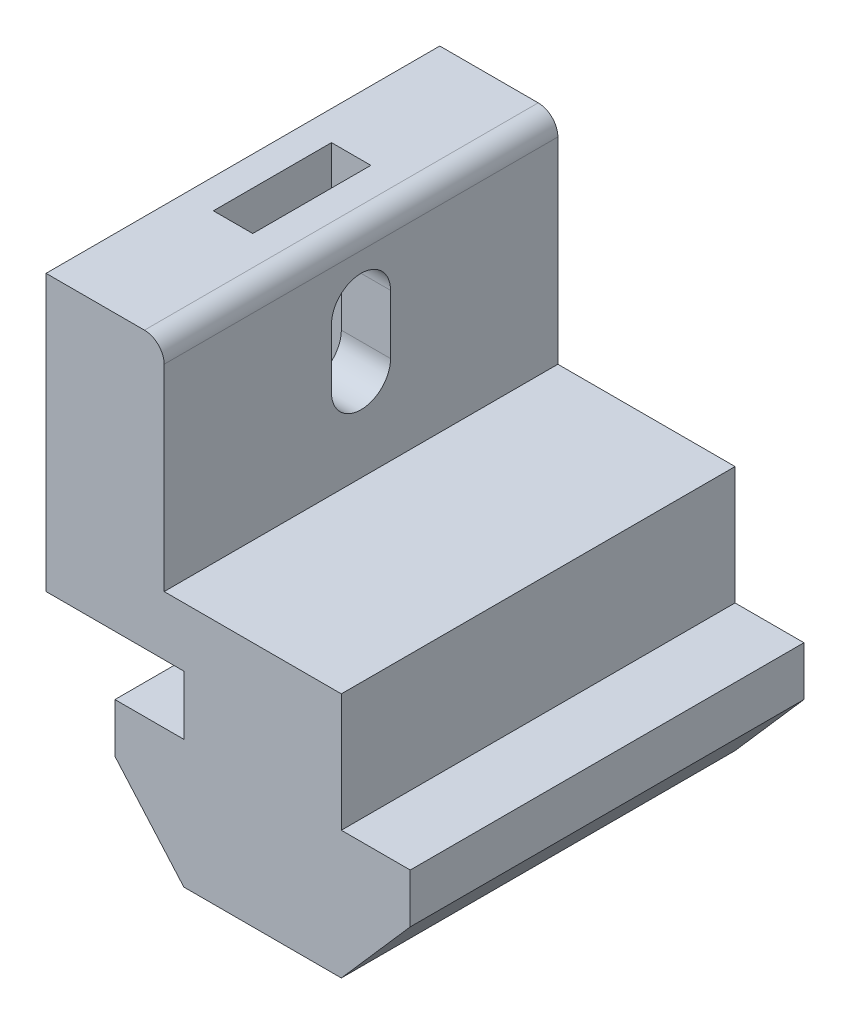
from build123d import *

# Parameters (mm, degrees)
ESTRUSIONE_ESTRUSIONE1_DEPTH = 20
TAGLIO_ESTRUSIONE1_REACH     = 37.979
ESTRUSIONE_ESTRUSIONE4_DEPTH = 0.6
SCHIZZO12_W                  = 2
SCHIZZO12_H                  = 6
TAGLIO_ESTRUSIONE2_DEPTH     = 11


with BuildPart() as part:
    # Schizzo2 → Estrusione-Estrusione1 (new body)
    with BuildSketch(Plane.XY):
        with BuildLine():
            Line((-4, 9.5), (-11, 9.5))
            Line((-11, 9.5), (-11, 23.5))
            Line((-11, 23.5), (-6, 23.5))
            ThreePointArc((-6, 23.5), (-5.292893219, 23.207106781), (-5, 22.5))
            Line((-5, 22.5), (-5, 12.5))
            Line((-5, 12.5), (4, 12.5))
            Line((4, 12.5), (4, 9.5))
            Line((4, 9.5), (4, 6.5))
            Line((4, 6.5), (7.5, 6.5))
            Line((7.5, 6.5), (7.5, 4))
            Line((7.5, 4), (4, 0))
            Line((4, 0), (-4, 0))
            Line((-4, 0), (-7.5, 4))
            Line((-7.5, 4), (-7.5, 6.5))
            Line((-7.5, 6.5), (-4, 6.5))
            Line((-4, 6.5), (-4, 9.5))
        make_face()
    extrude(amount=-ESTRUSIONE_ESTRUSIONE1_DEPTH)

    # Schizzo6 → Taglio-Estrusione1 (cut, up to next)
    with BuildSketch(Plane.ZY.offset(11), mode=Mode.PRIVATE) as taglio_estrusione1_sk1:
        with BuildLine():
            Line((-8.5, 20), (-8.5, 17))
            ThreePointArc((-8.5, 17), (-10, 15.5), (-11.5, 17))
            Line((-11.5, 17), (-11.5, 20))
            ThreePointArc((-11.5, 20), (-10, 21.5), (-8.5, 20))
        make_face()
    taglio_estrusione1_tool1 = extrude(taglio_estrusione1_sk1.sketch, amount=-TAGLIO_ESTRUSIONE1_REACH, mode=Mode.PRIVATE) & part.part
    add(taglio_estrusione1_tool1.solids().sort_by_distance((-11, 18.5, -10))[0], mode=Mode.SUBTRACT)

    # Schizzo11 → Estrusione-Estrusione4 (add)
    with BuildSketch(Plane(origin=(0, 0, -20), x_dir=(-1, 0, 0), z_dir=(0, 0, -1))):
        with BuildLine():
            Line((-1.916666667, 6), (-2.5, 6))
            add(Edge.make_bspline(
                [(-2.5, 6), (-2.484196549, 6.065431756), (-2.453302094, 6.193345487), (-2.388863743, 6.376101829), (-2.318665127, 6.549045511), (-2.234371075, 6.708938219), (-2.142426246, 6.858993324), (-2.037084049, 6.995807413), (-1.923204564, 7.122860063), (-1.797243944, 7.235613218), (-1.665147858, 7.337714716), (-1.525054993, 7.424768393), (-1.379783905, 7.499656106), (-1.228328086, 7.561350822), (-1.070236625, 7.607826795), (-0.906938753, 7.641546577), (-0.738006538, 7.66344436), (-0.623332441, 7.665581492), (-0.565104167, 7.666666667)],
                knots=[0, 0, 0, 0, 1.162005537, 2.271625781, 3.343758855, 4.383309926, 5.390229558, 6.379919256, 7.361854164, 8.333198761, 9.295911338, 10.242430842, 11.177959212, 12.116337295, 13.062827104, 14.020064771, 14.994644689, 16, 16, 16, 16], degree=3))
            add(Edge.make_bspline(
                [(-0.565104167, 7.666666667), (-0.480264789, 7.664105239), (-0.312436625, 7.659038256), (-0.065876681, 7.612768588), (0.171887412, 7.539550485), (0.398253158, 7.438384992), (0.608515961, 7.313608553), (0.795597451, 7.165102613), (0.956961828, 6.995732482), (1.092337101, 6.80865772), (1.198333527, 6.608726059), (1.276493935, 6.402954339), (1.324077057, 6.191830678), (1.330243806, 6.049281445), (1.333333333, 5.977864583)],
                knots=[0, 0, 0, 0, 1.083050992, 2.142477498, 3.193116406, 4.255571735, 5.30263384, 6.308962982, 7.297363603, 8.282367274, 9.249857812, 10.179914175, 11.08814088, 12, 12, 12, 12], degree=3))
            add(Edge.make_bspline(
                [(1.333333333, 5.977864583), (1.331172379, 5.909137679), (1.326943725, 5.774649792), (1.291038272, 5.578309869), (1.230613784, 5.393261183), (1.146912796, 5.218724739), (1.038564203, 5.055807179), (0.907314909, 4.904141953), (0.752238537, 4.763056374), (0.634720509, 4.682234495), (0.57421875, 4.640625)],
                knots=[0, 0, 0, 0, 1.024540389, 2.004866551, 2.965041327, 3.920577974, 4.882998113, 5.874504559, 6.905732034, 8, 8, 8, 8], degree=3))
            add(Edge.make_bspline(
                [(0.57421875, 4.640625), (0.643363437, 4.607236967), (0.780359061, 4.541085617), (0.967095758, 4.411353496), (1.136611813, 4.261563137), (1.231147291, 4.144669639), (1.278645833, 4.0859375)],
                knots=[0, 0, 0, 0, 1.015518401, 2.012035669, 3.001164323, 4, 4, 4, 4], degree=3))
            add(Edge.make_bspline(
                [(1.278645833, 4.0859375), (1.309922612, 4.043115961), (1.37196399, 3.958174116), (1.448544267, 3.821606468), (1.518018337, 3.683525131), (1.572154458, 3.540229091), (1.614077354, 3.393379209), (1.644044271, 3.24272333), (1.662660533, 3.088138431), (1.665326558, 2.983558111), (1.666666667, 2.930989583)],
                knots=[0, 0, 0, 0, 1.025084078, 2.033381695, 3.024893161, 4.013698104, 4.991890475, 5.976764909, 6.982997093, 8, 8, 8, 8], degree=3))
            add(Edge.make_bspline(
                [(1.666666667, 2.930989583), (1.663333999, 2.83997153), (1.656684346, 2.658363755), (1.597248208, 2.390053558), (1.505109333, 2.127777625), (1.374260737, 1.876924352), (1.214792507, 1.64221793), (1.025071762, 1.43221907), (0.807254146, 1.251707377), (0.56432937, 1.100888382), (0.301140417, 0.980326526), (0.019642889, 0.896648418), (-0.276107211, 0.842148704), (-0.478920764, 0.836304519), (-0.58203125, 0.833333333)],
                knots=[0, 0, 0, 0, 0.955779014, 1.907060117, 2.875433937, 3.871313158, 4.872415639, 5.851225146, 6.836215519, 7.83643374, 8.849228613, 9.86973379, 10.916971861, 12, 12, 12, 12], degree=3))
            add(Edge.make_bspline(
                [(-0.58203125, 0.833333333), (-0.651524236, 0.834945729), (-0.78826326, 0.838118387), (-0.9892869, 0.859807218), (-1.181170056, 0.899420085), (-1.364172166, 0.952726223), (-1.538455805, 1.020310887), (-1.703489143, 1.104474184), (-1.860287517, 1.203481259), (-2.007371283, 1.318500779), (-2.144722909, 1.447166124), (-2.268692254, 1.591761428), (-2.381346155, 1.74961375), (-2.479668199, 1.922556569), (-2.568136825, 2.108354904), (-2.640901459, 2.309387829), (-2.704946086, 2.523858156), (-2.73472252, 2.673316816), (-2.75, 2.75)],
                knots=[0, 0, 0, 0, 1.048658725, 2.063410685, 3.046034179, 4.001477787, 4.936774919, 5.862367409, 6.792675028, 7.730719943, 8.675894397, 9.627829632, 10.600096036, 11.597688215, 12.626045268, 13.701542398, 14.82072376, 16, 16, 16, 16], degree=3))
            Line((-2.75, 2.75), (-2.166666667, 2.75))
            add(Edge.make_bspline(
                [(-2.166666667, 2.75), (-2.151469125, 2.699951833), (-2.121908588, 2.602603799), (-2.071590606, 2.462500375), (-2.014263815, 2.33406399), (-1.952765349, 2.216352478), (-1.888176806, 2.108206588), (-1.815906231, 2.012485974), (-1.74130639, 1.924986312), (-1.685073305, 1.875689176), (-1.657552083, 1.8515625)],
                knots=[0, 0, 0, 0, 1.198163088, 2.33053128, 3.407730985, 4.417276592, 5.372219308, 6.28897303, 7.162600585, 8, 8, 8, 8], degree=3))
            add(Edge.make_bspline(
                [(-1.657552083, 1.8515625), (-1.621158441, 1.823504166), (-1.548483496, 1.767474107), (-1.430056781, 1.695971082), (-1.305507707, 1.634014892), (-1.172137598, 1.586688029), (-1.032824452, 1.54661523), (-0.885316488, 1.520391409), (-0.730915085, 1.502399091), (-0.625489239, 1.500811361), (-0.571614583, 1.5)],
                knots=[0, 0, 0, 0, 0.946170439, 1.889420265, 2.845303464, 3.807233317, 4.801018734, 5.828864929, 6.890507805, 8, 8, 8, 8], degree=3))
            add(Edge.make_bspline(
                [(-0.571614583, 1.5), (-0.51078665, 1.501143824), (-0.391842877, 1.503380473), (-0.218283853, 1.523949643), (-0.053170021, 1.553906125), (0.101665412, 1.600173093), (0.24825064, 1.657337532), (0.384530847, 1.729113142), (0.512295044, 1.813324768), (0.629906797, 1.909040348), (0.735662739, 2.013823125), (0.828778978, 2.123418828), (0.907939064, 2.237365369), (0.97179428, 2.356293307), (1.022216731, 2.479710161), (1.056542675, 2.607962273), (1.080409774, 2.740000053), (1.082353483, 2.829753852), (1.083333333, 2.875)],
                knots=[0, 0, 0, 0, 1.217147791, 2.380027433, 3.494444702, 4.572153297, 5.609568379, 6.639424714, 7.649109417, 8.668170816, 9.669597737, 10.625200337, 11.543417969, 12.441394052, 13.322311151, 14.205496177, 15.095365482, 16, 16, 16, 16], degree=3))
            add(Edge.make_bspline(
                [(1.083333333, 2.875), (1.080491345, 2.935563915), (1.074821509, 3.056390388), (1.031534147, 3.234151597), (0.960333399, 3.405423649), (0.860655878, 3.567284402), (0.739318097, 3.71729679), (0.597497555, 3.851143829), (0.43401656, 3.961588284), (0.283551089, 4.037895789), (0.150272941, 4.089964642), (0.036215798, 4.124646719), (-0.091475036, 4.154014937), (-0.231255399, 4.181337727), (-0.384178515, 4.204591659), (-0.5500779, 4.223983603), (-0.728987171, 4.239500107), (-0.852842194, 4.246429284), (-0.916666667, 4.25)],
                knots=[0, 0, 0, 0, 1.07054697, 2.135767047, 3.216561865, 4.33974944, 5.486079747, 6.621378074, 7.775625952, 8.963672916, 9.598146892, 10.304877434, 11.070270905, 11.915000392, 12.823868403, 13.805723172, 14.86925407, 16, 16, 16, 16], degree=3))
            Line((-0.916666667, 4.25), (-0.916666667, 4.916666667))
            add(Edge.make_bspline(
                [(-0.916666667, 4.916666667), (-0.836250216, 4.918031302), (-0.678734144, 4.920704288), (-0.448644721, 4.95303345), (-0.228622855, 4.997754616), (-0.02354462, 5.066255688), (0.163374419, 5.145816239), (0.325539394, 5.238398914), (0.460678382, 5.34131202), (0.568134658, 5.456144008), (0.648974654, 5.579300525), (0.708081563, 5.707660032), (0.742996455, 5.842347574), (0.747657265, 5.934266243), (0.75, 5.98046875)],
                knots=[0, 0, 0, 0, 1.321986639, 2.589447074, 3.816329219, 5.01088745, 6.139805852, 7.153945165, 8.075214402, 8.924034688, 9.728124013, 10.488707548, 11.240355623, 12, 12, 12, 12], degree=3))
            add(Edge.make_bspline(
                [(0.75, 5.98046875), (0.74923038, 6.014413134), (0.747699256, 6.081943876), (0.728390026, 6.180604717), (0.69937395, 6.276249331), (0.659483024, 6.368470979), (0.606089798, 6.456630059), (0.542192966, 6.541478178), (0.466109351, 6.622530911), (0.37892495, 6.698080076), (0.285303026, 6.770080088), (0.182696301, 6.831205413), (0.074198534, 6.883474814), (-0.040310397, 6.926578176), (-0.161202096, 6.959002568), (-0.28790856, 6.982283416), (-0.420671401, 6.996839061), (-0.511247475, 6.99893469), (-0.557291667, 7)],
                knots=[0, 0, 0, 0, 0.884392785, 1.759457502, 2.611959086, 3.489218968, 4.37281399, 5.2945488, 6.255912374, 7.266815255, 8.301784654, 9.332968512, 10.37626691, 11.440494194, 12.520033166, 13.637162961, 14.798855837, 16, 16, 16, 16], degree=3))
            add(Edge.make_bspline(
                [(-0.557291667, 7), (-0.631301907, 6.997416042), (-0.775861121, 6.992368971), (-0.984260252, 6.948163375), (-1.177996158, 6.877632648), (-1.326082253, 6.793442755), (-1.435435605, 6.710334806), (-1.51357849, 6.637753232), (-1.590316581, 6.557092273), (-1.660601409, 6.463383862), (-1.731681652, 6.362974109), (-1.79639298, 6.2507587), (-1.859275266, 6.129664825), (-1.897165715, 6.044058647), (-1.916666667, 6)],
                knots=[0, 0, 0, 0, 1.472543308, 2.876219568, 4.221790263, 5.565193594, 6.249813518, 6.953379497, 7.687249741, 8.463570142, 9.283606569, 10.136032583, 11.040678096, 12, 12, 12, 12], degree=3))
        make_face()
    extrude(amount=ESTRUSIONE_ESTRUSIONE4_DEPTH)

    # Schizzo12 → Taglio-Estrusione2 (cut)
    with BuildSketch(Plane(origin=(0, 23.5, 0), x_dir=(1, 0, 0), z_dir=(0, 1, 0))):
        with Locations((-8.5, 10)):
            Rectangle(SCHIZZO12_W, SCHIZZO12_H)
    extrude(amount=-TAGLIO_ESTRUSIONE2_DEPTH, mode=Mode.SUBTRACT)


solid = part.part
